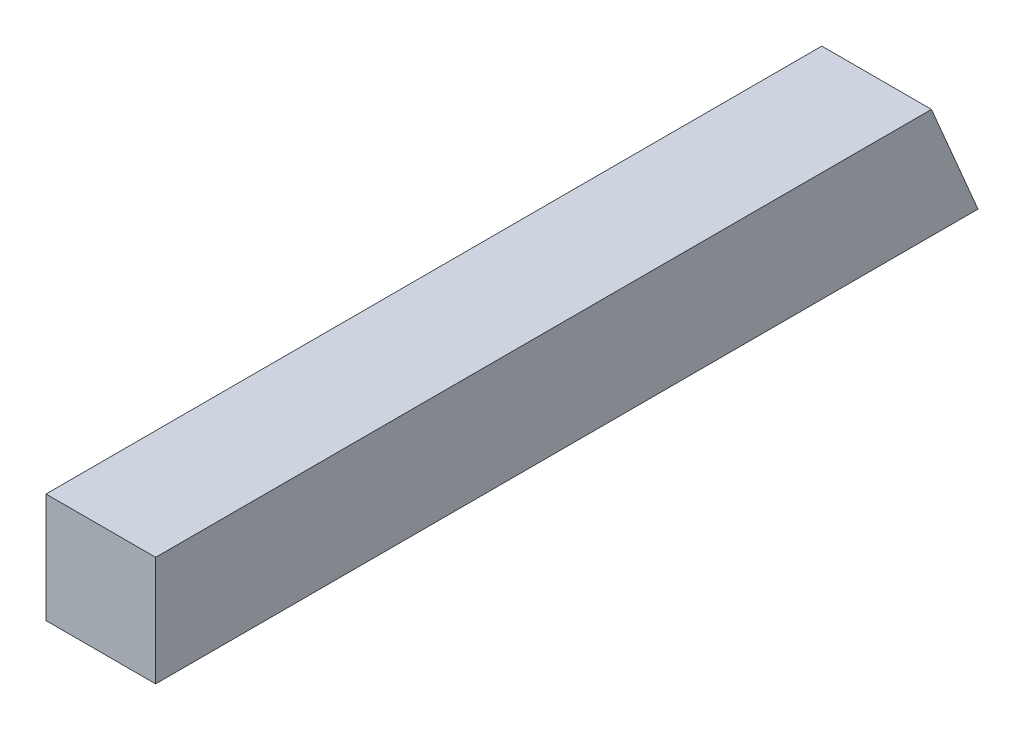
from build123d import *

# Parameters (mm, degrees)
SKETCH1_W           = 20
SKETCH1_H           = 20
BOSS_EXTRUDE1_DEPTH = 150
CUT_EXTRUDE1_DEPTH  = 152.657508881


with BuildPart() as part:
    # Sketch1 → Boss-Extrude1 (new body)
    with BuildSketch(Plane.XY):
        Rectangle(SKETCH1_W, SKETCH1_H)
    extrude(amount=BOSS_EXTRUDE1_DEPTH)

    # Sketch2 → Cut-Extrude1 (cut, through all)
    with BuildSketch(Plane(origin=(10, 0, 0), x_dir=(0, 0, -1), z_dir=(1, 0, 0))):
        Polygon((0, -10), (-8.489496324, 10), (0, 10), align=None)
    extrude(amount=-CUT_EXTRUDE1_DEPTH, mode=Mode.SUBTRACT)


solid = part.part
